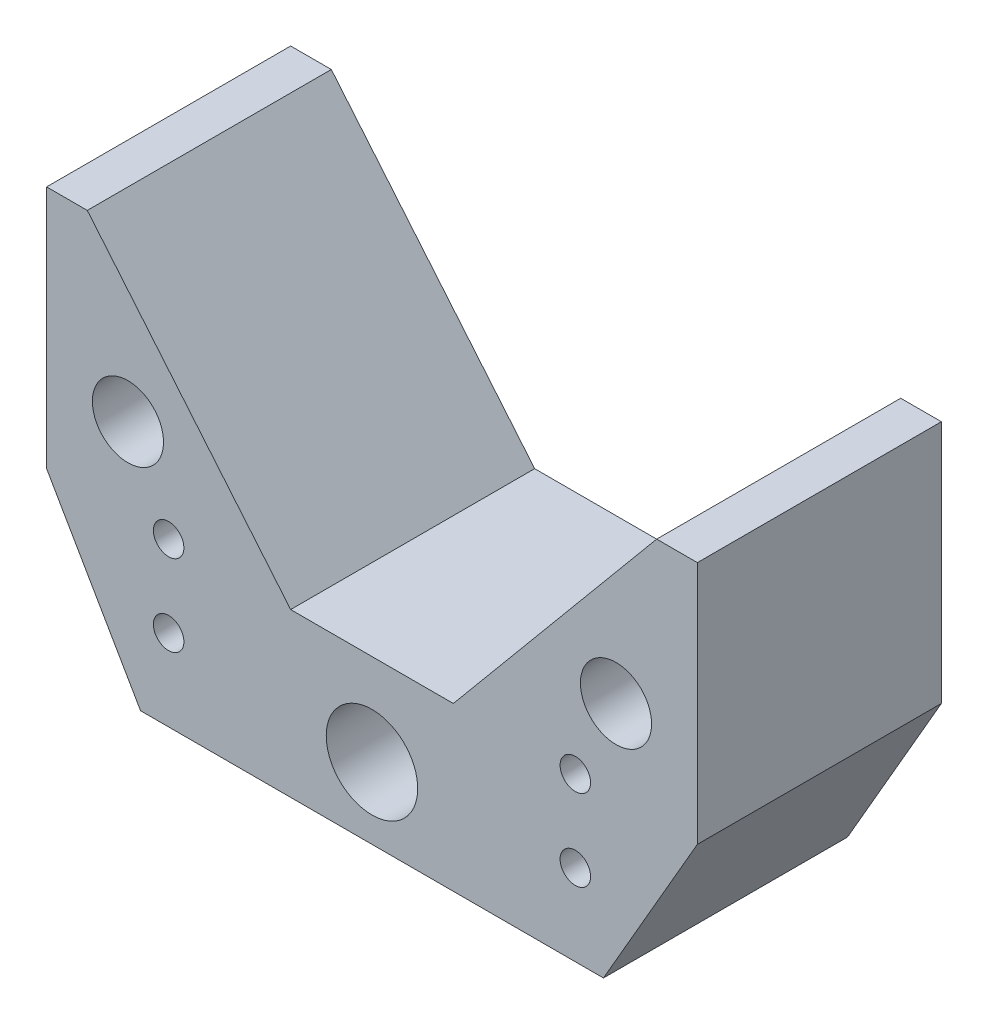
from build123d import *

# Parameters (mm, degrees)
SKETCH1_R           = 11.1125
SKETCH1_R_2         = 4.7625
SKETCH1_R_3         = 14.2875
BOSS_EXTRUDE4_DEPTH = 76.2


with BuildPart() as part:
    # Sketch1 → Boss-Extrude4 (new body)
    with BuildSketch(Plane.XY):
        Polygon((-72.270606325, 0), (72.270606325, 0), (101.6, 50.8), (101.6, 127), (88.9, 127), (25.4, 50.8), (-25.4, 50.8), (-88.9, 127), (-101.6, 127), (-101.6, 50.8), align=None)
        with Locations(Location((76.2, 76.2, 0), (0, 0, 180))):
            Circle(SKETCH1_R, mode=Mode.SUBTRACT)
        with Locations(Location((63.5, 50.8, 0), (0, 0, 180))):
            Circle(SKETCH1_R_2, mode=Mode.SUBTRACT)
        with Locations(Location((63.5, 25.4, 0), (0, 0, 180))):
            Circle(SKETCH1_R_2, mode=Mode.SUBTRACT)
        with Locations(Location((0, 22.225, 0), (0, 0, 180))):
            Circle(SKETCH1_R_3, mode=Mode.SUBTRACT)
        with Locations(Location((-63.5, 25.4, 0), (0, 0, 180))):
            Circle(SKETCH1_R_2, mode=Mode.SUBTRACT)
        with Locations(Location((-63.5, 50.8, 0), (0, 0, 180))):
            Circle(SKETCH1_R_2, mode=Mode.SUBTRACT)
        with Locations(Location((-76.2, 76.2, 0), (0, 0, 180))):
            Circle(SKETCH1_R, mode=Mode.SUBTRACT)
    extrude(amount=BOSS_EXTRUDE4_DEPTH)


solid = part.part
